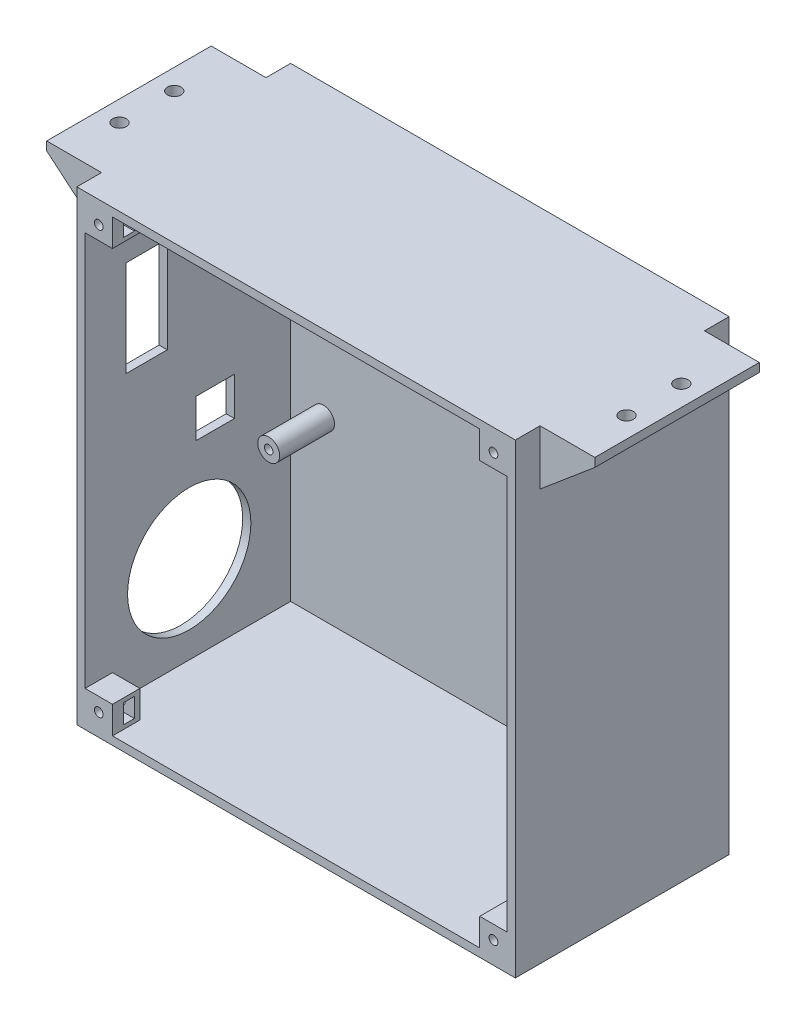
from build123d import *

# Parameters (mm, degrees)
SKETCH_1_W               = 160
SKETCH_1_H               = 170
EXTRUDE_1_DEPTH          = 3
SKETCH_9_W               = 160
SKETCH_9_H               = 170
SKETCH_9_W_2             = 154
SKETCH_9_H_2             = 164
EXTRUDE_6_DEPTH          = 75
SKETCH_10_R              = 4
SKETCH_10_R_2            = 1.55
EXTRUDE_7_DEPTH          = 20
SKETCH_11_W              = 14
SKETCH_11_H              = 14
CUT_EXTRUDE_3_DEPTH      = 20
SKETCH_12_R              = 22.5
CUT_EXTRUDE_4_DEPTH      = 10
SKETCH_13_W              = 15
SKETCH_13_H              = 35
CUT_EXTRUDE_5_DEPTH      = 10
SKETCH_14_W              = 10
SKETCH_14_H              = 10
EXTRUDE_8_DEPTH          = 10
SKETCH_15_W              = 4
SKETCH_15_H              = 7
CUT_EXTRUDE_6_DEPTH      = 10
SKETCH_16_R              = 1.6
CUT_EXTRUDE_7_DEPTH      = 20
MIRROR_4_COPY_1_SKETCH_W = 10
MIRROR_4_COPY_1_SKETCH_H = 10
MIRROR_4_COPY_1_DEPTH    = 10
MIRROR_4_COPY_2_SKETCH_W = 4
MIRROR_4_COPY_2_SKETCH_H = 7
MIRROR_4_COPY_2_DEPTH    = 10
MIRROR_4_COPY_3_SKETCH_R = 1.6
MIRROR_4_COPY_3_DEPTH    = 20
SKETCH_17_W              = 60
SKETCH_17_H              = 20
EXTRUDE_9_DEPTH          = 20
SKETCH_18_W              = 15
SKETCH_18_H              = 15
CUT_EXTRUDE_8_DEPTH      = 15
SKETCH_19_R              = 2.5
CUT_EXTRUDE_9_DEPTH      = 15
CUT_EXTRUDE_10_DEPTH     = 65


with BuildPart() as part:
    # 草图1 → 凸台-拉伸1 (new body)
    with BuildSketch(Plane.XY):
        with Locations((52.885281107, -76.271289123)):
            Rectangle(SKETCH_1_W, SKETCH_1_H)
    extrude(amount=EXTRUDE_1_DEPTH)

    # 草图9 → 凸台-拉伸6 (add)
    with BuildSketch(Plane.XY.offset(3)):
        with Locations((52.885281107, -76.271289123)):
            Rectangle(SKETCH_9_W, SKETCH_9_H)
        with Locations((52.885281107, -76.271289123)):
            Rectangle(SKETCH_9_W_2, SKETCH_9_H_2, mode=Mode.SUBTRACT)
    extrude(amount=EXTRUDE_6_DEPTH)

    # 草图10 → 凸台-拉伸7 (add)
    # profile 1 of 4: a face of its own
    with BuildSketch(Plane.XY.offset(3)):
        with Locations((-12.114718893, -0.271289123)):
            Circle(SKETCH_10_R)
        with Locations((-12.114718893, -0.271289123)):
            Circle(SKETCH_10_R_2, mode=Mode.SUBTRACT)
    # profile 2 of 4: a face of its own
    with BuildSketch(Plane.XY.offset(3)):
        with Locations((81.885281107, -0.271289123)):
            Circle(SKETCH_10_R)
        with Locations((81.885281107, -0.271289123)):
            Circle(SKETCH_10_R_2, mode=Mode.SUBTRACT)
    # profile 3 of 4: a face of its own
    with BuildSketch(Plane.XY.offset(3)):
        with Locations((-12.114718893, -94.271289123)):
            Circle(SKETCH_10_R)
        with Locations((-12.114718893, -94.271289123)):
            Circle(SKETCH_10_R_2, mode=Mode.SUBTRACT)
    # profile 4 of 4: a face of its own
    with BuildSketch(Plane.XY.offset(3)):
        with Locations((81.885281107, -94.271289123)):
            Circle(SKETCH_10_R)
        with Locations((81.885281107, -94.271289123)):
            Circle(SKETCH_10_R_2, mode=Mode.SUBTRACT)
    extrude(amount=EXTRUDE_7_DEPTH)

    # 草图11 → 切除-拉伸3 (cut)
    with BuildSketch(Plane(origin=(-24.114718893, 0, 0), x_dir=(0, 0, -1), z_dir=(1, 0, 0))):
        with Locations((-30.5, -83.221289123)):
            Rectangle(SKETCH_11_W, SKETCH_11_H)
    extrude(amount=-CUT_EXTRUDE_3_DEPTH, mode=Mode.SUBTRACT)

    # 草图12 → 切除-拉伸4 (cut)
    with BuildSketch(Plane.ZY.offset(27.114718893)):
        with Locations(Location((40, -126.271289123, 0), (0, 0, 270))):
            Circle(SKETCH_12_R)
    extrude(amount=-CUT_EXTRUDE_4_DEPTH, mode=Mode.SUBTRACT)

    # 草图13 → 切除-拉伸5 (cut)
    with BuildSketch(Plane.ZY.offset(27.114718893)):
        with Locations((55.5, -38.771289123)):
            Rectangle(SKETCH_13_W, SKETCH_13_H)
    extrude(amount=-CUT_EXTRUDE_5_DEPTH, mode=Mode.SUBTRACT)

    # 草图14 → 凸台-拉伸8 (add)
    with BuildSketch(Plane.XZ.offset(-5.728710877)):
        with Locations((-19.114718893, 73)):
            Rectangle(SKETCH_14_W, SKETCH_14_H)
    extrude_8 = extrude(amount=EXTRUDE_8_DEPTH)

    # 草图15 → 切除-拉伸6 (cut)
    with BuildSketch(Plane(origin=(-14.114718893, 0, 0), x_dir=(0, 0, -1), z_dir=(1, 0, 0))):
        with Locations((-72, 0.728710877)):
            Rectangle(SKETCH_15_W, SKETCH_15_H)
    cut_extrude_6 = extrude(amount=-CUT_EXTRUDE_6_DEPTH, mode=Mode.SUBTRACT)

    # 草图16 → 切除-拉伸7 (cut)
    with BuildSketch(Plane.XY.offset(78)):
        with Locations((-19.114718893, 0.728710877)):
            Circle(SKETCH_16_R)
    cut_extrude_7 = extrude(amount=-CUT_EXTRUDE_7_DEPTH, mode=Mode.SUBTRACT)

    # 镜向3: 凸台-拉伸8, 切除-拉伸6, 切除-拉伸7 across plane
    add(extrude_8.mirror(Plane.ZY.offset(-52.885281107)))
    add(cut_extrude_6.mirror(Plane.ZY.offset(-52.885281107)), mode=Mode.SUBTRACT)
    add(cut_extrude_7.mirror(Plane.ZY.offset(-52.885281107)), mode=Mode.SUBTRACT)

    # 镜向4: 凸台-拉伸8, 切除-拉伸6, 切除-拉伸7 across plane
    add(extrude_8.mirror(Plane.ZX.offset(-76.271289123)))
    add(cut_extrude_6.mirror(Plane.ZX.offset(-76.271289123)), mode=Mode.SUBTRACT)
    add(cut_extrude_7.mirror(Plane.ZX.offset(-76.271289123)), mode=Mode.SUBTRACT)

    # 镜向4 copy 1 sketch → 镜向4 copy 1 (add)
    with BuildSketch(Plane(origin=(105.770562214, -158.271289123, 0), x_dir=(-1, 0, 0), z_dir=(0, 1, 0))):
        with Locations((-19.114718893, 73)):
            Rectangle(MIRROR_4_COPY_1_SKETCH_W, MIRROR_4_COPY_1_SKETCH_H)
    extrude(amount=MIRROR_4_COPY_1_DEPTH)

    # 镜向4 copy 2 sketch → 镜向4 copy 2 (cut)
    with BuildSketch(Plane(origin=(119.885281107, -152.542578247, 0), x_dir=(0, 0, -1), z_dir=(-1, 0, 0))):
        with Locations((-72, 0.728710877)):
            Rectangle(MIRROR_4_COPY_2_SKETCH_W, MIRROR_4_COPY_2_SKETCH_H)
    extrude(amount=-MIRROR_4_COPY_2_DEPTH, mode=Mode.SUBTRACT)

    # 镜向4 copy 3 sketch → 镜向4 copy 3 (cut)
    with BuildSketch(Plane(origin=(105.770562214, -152.542578247, 78), x_dir=(-1, 0, 0), z_dir=(0, 0, 1))):
        with Locations((-19.114718893, 0.728710877)):
            Circle(MIRROR_4_COPY_3_SKETCH_R)
    extrude(amount=-MIRROR_4_COPY_3_DEPTH, mode=Mode.SUBTRACT)

    # 草图17 → 凸台-拉伸9 (add)
    with BuildSketch(Plane.ZY.offset(27.114718893)):
        with Locations((39, -1.271289123)):
            Rectangle(SKETCH_17_W, SKETCH_17_H)
    extrude_9 = extrude(amount=EXTRUDE_9_DEPTH)

    # 草图18 → 切除-拉伸8 (cut)
    with BuildSketch(Plane.ZY.offset(47.114718893)):
        with Locations((29.95, -3.771289123)):
            Rectangle(SKETCH_18_W, SKETCH_18_H)
        with Locations((49.95, -3.771289123)):
            Rectangle(SKETCH_18_W, SKETCH_18_H)
    cut_extrude_8 = extrude(amount=-CUT_EXTRUDE_8_DEPTH, mode=Mode.SUBTRACT)

    # 草图19 → 切除-拉伸9 (cut)
    with BuildSketch(Plane(origin=(0, 3.728710877, 0), x_dir=(-1, 0, 0), z_dir=(0, -1, 0))):
        with Locations(Location((39.614718893, -49.95, 0), (0, 0, 90))):
            Circle(SKETCH_19_R)
        with Locations(Location((39.614718893, -29.95, 0), (0, 0, 90))):
            Circle(SKETCH_19_R)
    cut_extrude_9 = extrude(amount=-CUT_EXTRUDE_9_DEPTH, mode=Mode.SUBTRACT)

    # 草图20 → 切除-拉伸10 (cut)
    with BuildSketch(Plane.XY.offset(69)):
        Polygon((-47.114718893, -11.271289123), (-27.114718893, -11.271289123), (-47.114718893, 5.558007734), align=None)
    cut_extrude_10 = extrude(amount=-CUT_EXTRUDE_10_DEPTH, mode=Mode.SUBTRACT)

    # 镜向5: 凸台-拉伸9, 切除-拉伸8, 切除-拉伸9, 切除-拉伸10 across plane
    add(extrude_9.mirror(Plane.ZY.offset(-52.885281107)))
    add(cut_extrude_8.mirror(Plane.ZY.offset(-52.885281107)), mode=Mode.SUBTRACT)
    add(cut_extrude_9.mirror(Plane.ZY.offset(-52.885281107)), mode=Mode.SUBTRACT)
    add(cut_extrude_10.mirror(Plane.ZY.offset(-52.885281107)), mode=Mode.SUBTRACT)


solid = part.part
